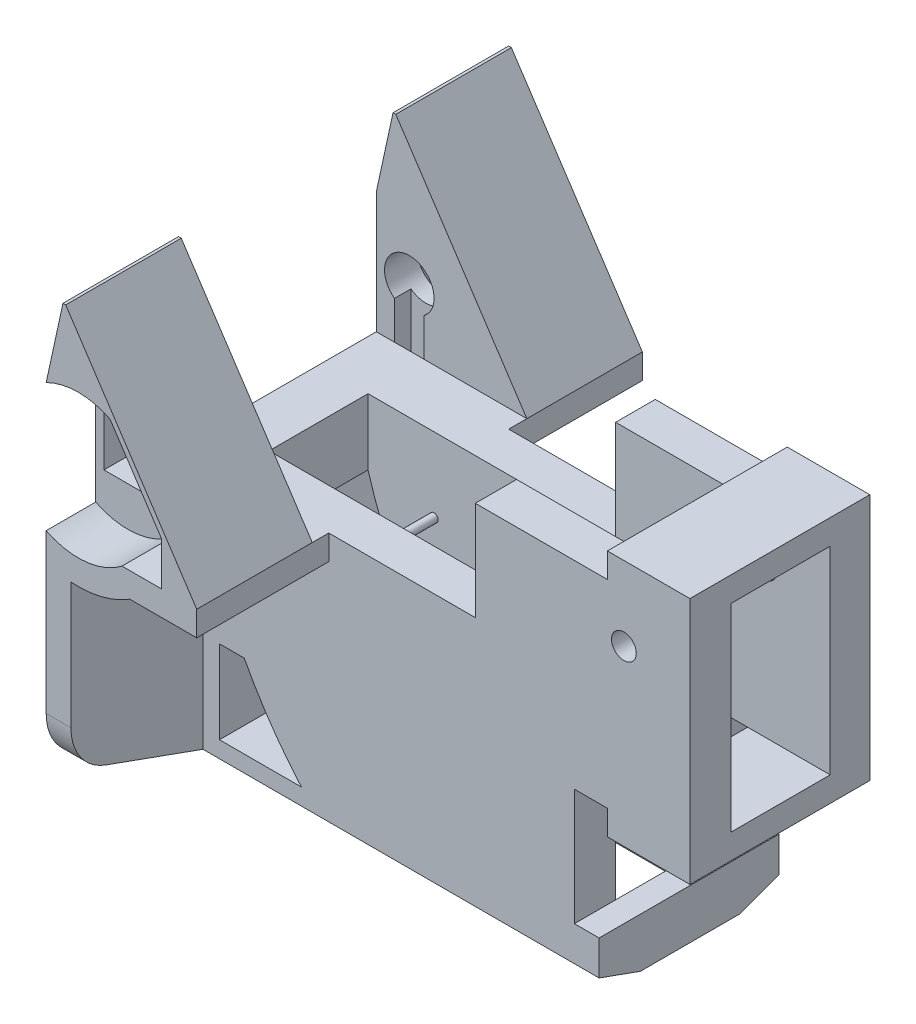
from build123d import *

# Parameters (mm, degrees)
EXTRUDE_1_DEPTH           = 30
EXTRUDE_2_DEPTH           = 210
SKETCH_8_W                = 25
SKETCH_8_H                = 120
EXTRUDE_5_DEPTH           = 70
SKETCH_9_W                = 25
SKETCH_9_H                = 60
EXTRUDE_6_DEPTH           = 60
SKETCH_10_R               = 7.5
CUT_EXTRUDE_3_DEPTH       = 402.372644808
EXTRUDE_7_DEPTH           = 60
EXTRUDE_8_REACH           = 392.16
SKETCH_12_R               = 2.5
SKETCH_14_W               = 125
SKETCH_14_H               = 50
EXTRUDE_9_DEPTH           = 120
SKETCH_15_W               = 70
SKETCH_15_H               = 70
CUT_EXTRUDE_4_DEPTH       = 10
CUT_EXTRUDE_5_DEPTH       = 20
SKETCH_17_R               = 43.471266984
CUT_EXTRUDE_6_DEPTH       = 428.317212384
EXTRUDE_10_DEPTH          = 20
EXTRUDE_11_DEPTH          = 20
CUT_EXTRUDE_7_DEPTH       = 434.012701892
CUT_EXTRUDE_8_DEPTH       = 434.012701892
EXTRUDE_19_REACH          = 446.86
EXTRUDE_20_DEPTH          = 20
EXTRUDE_21_DEPTH          = 20
EXTRUDE_START             = 20
EXTRUDE_22_DEPTH          = 20
CUT_EXTRUDE_9_DEPTH       = 30
CUT_EXTRUDE_11_DEPTH      = 407.201920232
CUT_EXTRUDE_11_DEPTH_BACK = 407.201920232
SKETCH_29_R               = 15
EXTRUDE_23_DEPTH          = 78.20324
SKETCH_33_W               = 30
SKETCH_33_H               = 40
CUT_EXTRUDE_14_DEPTH      = 20
SKETCH_34_W               = 18
SKETCH_34_H               = 35.300600551
CUT_EXTRUDE_15_DEPTH      = 10
CUT_EXTRUDE_16_DEPTH      = 10
SKETCH_36_RX              = 24.05
SKETCH_36_RY              = 15.9
SKETCH_36_R               = 15.9
CUT_EXTRUDE_17_DEPTH      = 4
SKETCH_37_W               = 148.788525811
SKETCH_37_H               = 80
CUT_EXTRUDE_18_DEPTH      = 445.859528391
SKETCH_38_W               = 76.211474189
SKETCH_38_H               = 51.3
CUT_EXTRUDE_20_DEPTH      = 80
CUT_EXTRUDE_START         = -81
CUT_EXTRUDE_21_DEPTH      = 81
CUT_EXTRUDE_22_DEPTH      = 402.372644808
SKETCH_41_W               = 18
SKETCH_41_H               = 10
CUT_EXTRUDE_23_DEPTH      = 60
SKETCH_44_W               = 50
SKETCH_44_H               = 109
EXTRUDE_26_DEPTH          = 15
SKETCH_45_W               = 50
SKETCH_45_H               = 109
EXTRUDE_27_DEPTH          = 15
EXTRUDE_28_DEPTH          = 15
SKETCH_47_W               = 15
SKETCH_47_H               = 50.339258453
CUT_EXTRUDE_24_DEPTH      = 109


with BuildPart() as part:
    # 草图1 → 凸台-拉伸1 (new body)
    with BuildSketch(Plane(origin=(0, 0, 0), x_dir=(0, 0, -1), z_dir=(1, 0, 0))):
        with BuildLine():
            Line((0, 0), (270, 0))
            Line((270, 0), (270, -100.282814983))
            ThreePointArc((270, -100.282814983), (264.178138298, -118.691056762), (248.830033233, -130.404003019))
            Line((248.830033233, -130.404003019), (142.45524498, -168.69892679))
            ThreePointArc((142.45524498, -168.69892679), (135, -170), (127.54475502, -168.69892679))
            Line((127.54475502, -168.69892679), (21.169966767, -130.404003019))
            ThreePointArc((21.169966767, -130.404003019), (5.821861702, -118.691056762), (0, -100.282814983))
            Line((0, -100.282814983), (0, 0))
        make_face()
    extrude(amount=EXTRUDE_1_DEPTH)

    # 草图2 → 凸台-拉伸2 (add)
    with BuildSketch(Plane(origin=(30, 0, 0), x_dir=(0, 0, -1), z_dir=(1, 0, 0))):
        with BuildLine():
            Line((105, -160.582814983), (105, 0))
            Line((105, 0), (0, 0))
            Line((0, 0), (0, -100.282814983))
            ThreePointArc((0, -100.282814983), (5.821861702, -118.691056762), (21.169966767, -130.404003019))
            Line((21.169966767, -130.404003019), (105, -160.582814983))
        make_face()
        with BuildLine():
            Line((270, 0), (165, 0))
            Line((165, 0), (165, -160.582814983))
            Line((165, -160.582814983), (248.830033233, -130.404003019))
            ThreePointArc((248.830033233, -130.404003019), (264.178138298, -118.691056762), (270, -100.282814983))
            Line((270, -100.282814983), (270, 0))
        make_face()
    extrude(amount=EXTRUDE_2_DEPTH)

    # 草图8 → 凸台-拉伸5 (add)
    with BuildSketch(Plane(origin=(240, 0, 0), x_dir=(0, 0, -1), z_dir=(1, 0, 0))):
        with Locations((92.5, 0)):
            Rectangle(SKETCH_8_W, SKETCH_8_H)
        with Locations((177.5, 0)):
            Rectangle(SKETCH_8_W, SKETCH_8_H)
    extrude(amount=EXTRUDE_5_DEPTH)

    # 草图9 → 凸台-拉伸6 (add)
    with BuildSketch(Plane.ZY.offset(-240)):
        with Locations((-92.5, 30)):
            Rectangle(SKETCH_9_W, SKETCH_9_H)
        with Locations((-177.5, 30)):
            Rectangle(SKETCH_9_W, SKETCH_9_H)
    extrude(amount=EXTRUDE_6_DEPTH)

    # 草图10 → 切除-拉伸3 (cut, through all)
    with BuildSketch(Plane.XY.offset(-80)):
        with Locations((270, 30)):
            Circle(SKETCH_10_R)
    extrude(amount=-CUT_EXTRUDE_3_DEPTH, mode=Mode.SUBTRACT)

    # 草图11 → 凸台-拉伸7 (add)
    with BuildSketch(Plane(origin=(0, 0, -105), x_dir=(-1, 0, 0), z_dir=(0, 0, -1))):
        with BuildLine():
            Line((-30, -40), (-30, -160.582814983))
            Line((-30, -160.582814983), (-108.203242822, -160.582814983))
            ThreePointArc((-108.203242822, -160.582814983), (-60.24964282, -106.032303748), (-30, -40))
        make_face()
    extrude(amount=EXTRUDE_7_DEPTH)

    # 草图12 → 凸台-拉伸8 (add, up to next)
    with BuildSketch(Plane.XY.offset(-165), mode=Mode.PRIVATE) as extrude_8_sk1:
        with Locations(Location((70, -45, 0), (0, 0, 180))):
            Circle(SKETCH_12_R)
    extrude_8_tool1 = extrude(extrude_8_sk1.sketch, amount=EXTRUDE_8_REACH, mode=Mode.PRIVATE) - part.part
    add(extrude_8_tool1.solids().sort_by_distance((70, -45, -165))[0])

    # 草图14 → 凸台-拉伸9 (add)
    with BuildSketch(Plane(origin=(0, 0, 0), x_dir=(1, 0, 0), z_dir=(0, 1, 0))):
        with Locations((62.5, 225)):
            Rectangle(SKETCH_14_W, SKETCH_14_H)
        with Locations((62.5, 45)):
            Rectangle(SKETCH_14_W, SKETCH_14_H)
    extrude(amount=EXTRUDE_9_DEPTH)

    # 草图15 → 切除-拉伸4 (cut)
    with BuildSketch(Plane.XY.offset(-20)):
        with Locations((35, 35)):
            Rectangle(SKETCH_15_W, SKETCH_15_H)
    extrude(amount=-CUT_EXTRUDE_4_DEPTH, mode=Mode.SUBTRACT)

    # 草图16 → 切除-拉伸5 (cut)
    with BuildSketch(Plane.XY.offset(-30)):
        Polygon((35, 15), (5, 15), (5, 55), (35, 55), (35, 35), align=None)
    extrude(amount=-CUT_EXTRUDE_5_DEPTH, mode=Mode.SUBTRACT)

    # 草图17 → 切除-拉伸6 (cut, through all)
    with BuildSketch(Plane.XY.offset(-30)):
        with Locations((19.5, 34.5)):
            Circle(SKETCH_17_R)
    extrude(amount=CUT_EXTRUDE_6_DEPTH, mode=Mode.SUBTRACT)

    # 草图18 → 凸台-拉伸10 (add)
    with BuildSketch(Plane.XY.offset(-20)):
        Polygon((11.819921283, 120), (91.211474189, 0), (87.317867735, 0), (10.741661946, 115.744614613), align=None)
    extrude(amount=EXTRUDE_10_DEPTH)

    # 草图19 → 凸台-拉伸11 (add)
    with BuildSketch(Plane.XY.offset(-20)):
        with BuildLine():
            Line((1.857343832, 74.230186717), (10.856035233, 115.571739869))
            Line((10.856035233, 115.571739869), (10.741661946, 115.744614613))
            Line((10.741661946, 115.744614613), (11.819921283, 120))
            Line((11.819921283, 120), (10.153664863, 120))
            Line((10.153664863, 120), (0, 73.352297914))
            ThreePointArc((0, 73.352297914), (0.923485284, 73.80221564), (1.857343832, 74.230186717))
        make_face()
    extrude(amount=EXTRUDE_11_DEPTH)

    # 草图20 → 切除-拉伸7 (cut, through all)
    with BuildSketch(Plane.XY.offset(-20)):
        Polygon((0, 120), (0, 73.352297914), (10.153664863, 120), align=None)
    extrude(amount=-CUT_EXTRUDE_7_DEPTH, mode=Mode.SUBTRACT)

    # 草图22 → 切除-拉伸8 (cut, through all)
    with BuildSketch(Plane.XY.offset(-20)):
        Polygon((44.899734993, 70), (70, 32.061054476), (91.211474189, 0), (125, 0), (125, 120), (11.819921283, 120), align=None)
    extrude(amount=-CUT_EXTRUDE_8_DEPTH, mode=Mode.SUBTRACT)

    # 草图23 → 凸台-拉伸19 (add, up to next)
    with BuildSketch(Plane.XY, mode=Mode.PRIVATE) as extrude_19_sk1:
        with BuildLine():
            Line((87.317867735, 0), (91.211474189, 0))
            Line((91.211474189, 0), (11.819921283, 120))
            Line((11.819921283, 120), (10.153664863, 120))
            Line((10.153664863, 120), (0, 73.352297914))
            ThreePointArc((0, 73.352297914), (0.923485284, 73.80221564), (1.857343832, 74.230186717))
            Line((1.857343832, 74.230186717), (10.856035233, 115.571739869))
            Line((10.856035233, 115.571739869), (87.317867735, 0))
        make_face()
    extrude_19_tool1 = extrude(extrude_19_sk1.sketch, amount=-EXTRUDE_19_REACH, mode=Mode.PRIVATE) - part.part
    add(extrude_19_tool1.solids().sort_by_distance((89.264671, 1.5073, 0))[0])

    # 草图24 → 凸台-拉伸20 (add)
    with BuildSketch(Plane.XY.offset(-20)):
        Polygon((87.317867735, 0), (70, 26.175884614), (70, 0), align=None)
    extrude(amount=EXTRUDE_20_DEPTH)

    # 草图25 → 凸台-拉伸21 (add)
    with BuildSketch(Plane.XY.offset(-20)):
        with BuildLine():
            Line((38.684579851, 73.509011127), (10.856035233, 115.571739869))
            Line((10.856035233, 115.571739869), (1.857343832, 74.230186717))
            ThreePointArc((1.857343832, 74.230186717), (20.351120273, 77.962934179), (38.684579851, 73.509011127))
        make_face()
    extrude(amount=EXTRUDE_21_DEPTH)

    # 草图26 → 凸台-拉伸22 (add)
    with BuildSketch(Plane(origin=(0, 0, -250), x_dir=(-1, 0, 0), z_dir=(0, 0, -1)).offset(EXTRUDE_START)):
        with BuildLine():
            Line((-70, 26.175884614), (-38.684579851, 73.509011127))
            ThreePointArc((-38.684579851, 73.509011127), (-19.323897117, 77.970910285), (0, 73.352297914))
            Line((0, 73.352297914), (-10.153664863, 120))
            Line((-10.153664863, 120), (-11.819921283, 120))
            Line((-11.819921283, 120), (-91.211474189, 0))
            Line((-91.211474189, 0), (-240, 0))
            Line((-240, 0), (-240, -100.282814983))
            Line((-240, -100.282814983), (0, -100.282814983))
            Line((0, -100.282814983), (0, -4.352297914))
            ThreePointArc((0, -4.352297914), (-23.599339693, -8.77755154), (-45.948082222, 0))
            Line((-45.948082222, 0), (-70, 0))
            Line((-70, 0), (-70, 26.175884614))
        make_face()
    extrude(amount=-EXTRUDE_22_DEPTH)

    # 草图27 → 切除-拉伸9 (cut)
    with BuildSketch(Plane(origin=(0, 0, -270), x_dir=(-1, 0, 0), z_dir=(0, 0, -1))):
        with BuildLine():
            Line((-38.684579851, 73.509011127), (-70, 26.175884614))
            Line((-70, 26.175884614), (-70, 0))
            Line((-70, 0), (-45.948082222, 0))
            ThreePointArc((-45.948082222, 0), (-23.599339693, -8.77755154), (0, -4.352297914))
            Line((0, -4.352297914), (0, 73.352297914))
            ThreePointArc((0, 73.352297914), (-19.323897117, 77.970910285), (-38.684579851, 73.509011127))
        make_face()
    extrude(amount=-CUT_EXTRUDE_9_DEPTH, mode=Mode.SUBTRACT)

    # 草图29 → 切除-拉伸11 (cut, two sides: drawn at the far end of the back side and taken through both)
    with BuildSketch(Plane(origin=(0, 0, -70), x_dir=(-1, 0, 0), z_dir=(0, 0, -1)).offset(-CUT_EXTRUDE_11_DEPTH_BACK)):
        with Locations((-20, 35)):
            Circle(SKETCH_29_R)
    extrude(amount=CUT_EXTRUDE_11_DEPTH + CUT_EXTRUDE_11_DEPTH_BACK, mode=Mode.SUBTRACT)

    # 草图30 → 凸台-拉伸23 (add)
    with BuildSketch(Plane(origin=(30, 0, 0), x_dir=(0, 0, -1), z_dir=(1, 0, 0))):
        with BuildLine():
            Line((142.45524498, -168.69892679), (165, -160.582814983))
            Line((165, -160.582814983), (105, -160.582814983))
            Line((105, -160.582814983), (127.54475502, -168.69892679))
            ThreePointArc((127.54475502, -168.69892679), (135, -170), (142.45524498, -168.69892679))
        make_face()
    extrude(amount=EXTRUDE_23_DEPTH)

    # 草图33 → 切除-拉伸14 (cut)
    with BuildSketch(Plane(origin=(0, 0, -240), x_dir=(-1, 0, 0), z_dir=(0, 0, -1))):
        with Locations((-20, 35)):
            Rectangle(SKETCH_33_W, SKETCH_33_H)
    extrude(amount=-CUT_EXTRUDE_14_DEPTH, mode=Mode.SUBTRACT)

    # 草图34 → 切除-拉伸15 (cut)
    with BuildSketch(Plane.XY.offset(-200)):
        with Locations((20, 17.650300276)):
            Rectangle(SKETCH_34_W, SKETCH_34_H)
    extrude(amount=-CUT_EXTRUDE_15_DEPTH, mode=Mode.SUBTRACT)

    # 草图35 → 切除-拉伸16 (cut)
    with BuildSketch(Plane(origin=(0, 0, -70), x_dir=(-1, 0, 0), z_dir=(0, 0, -1))):
        with BuildLine():
            Line((-11, 0), (-11, 23))
            ThreePointArc((-11, 23), (-20, 20), (-29, 23))
            Line((-29, 23), (-29, 0))
            Line((-29, 0), (-11, 0))
        make_face()
    extrude(amount=-CUT_EXTRUDE_16_DEPTH, mode=Mode.SUBTRACT)

    # 草图36 → 切除-拉伸17 (cut)
    # profile 1 of 6: a face of its own
    with BuildSketch(Plane.ZY):
        with Locations((-235.69166945, -100.008005659)):
            Ellipse(SKETCH_36_RX, SKETCH_36_RY)
        with Locations((-235.69166945, -100.008005659)):
            Circle(SKETCH_36_R, mode=Mode.SUBTRACT)
    # profile 2 of 6: a face of its own
    with BuildSketch(Plane.ZY):
        with Locations((-235.69166945, -100.008005659)):
            Ellipse(SKETCH_36_RX, SKETCH_36_RY)
        with Locations((-235.69166945, -100.008005659)):
            Circle(SKETCH_36_R, mode=Mode.SUBTRACT)
    # profile 3 of 6: a face of its own
    with BuildSketch(Plane.ZY):
        with Locations((-235.69166945, -100.008005659)):
            Circle(SKETCH_36_R)
    # profile 4 of 6: a face of its own
    with BuildSketch(Plane.ZY):
        with Locations(Location((-34.30833055, -100.008005659), (0, 0, 180))):
            Ellipse(SKETCH_36_RX, SKETCH_36_RY)
        with Locations((-34.30833055, -100.008005659)):
            Circle(SKETCH_36_R, mode=Mode.SUBTRACT)
    # profile 5 of 6: a face of its own
    with BuildSketch(Plane.ZY):
        with Locations(Location((-34.30833055, -100.008005659), (0, 0, 180))):
            Ellipse(SKETCH_36_RX, SKETCH_36_RY)
        with Locations((-34.30833055, -100.008005659)):
            Circle(SKETCH_36_R, mode=Mode.SUBTRACT)
    # profile 6 of 6: a face of its own
    with BuildSketch(Plane.ZY):
        with Locations((-34.30833055, -100.008005659)):
            Circle(SKETCH_36_R)
    extrude(amount=-CUT_EXTRUDE_17_DEPTH, mode=Mode.SUBTRACT)

    # 草图37 → 切除-拉伸18 (cut, through all)
    with BuildSketch(Plane(origin=(0, 0, 0), x_dir=(1, 0, 0), z_dir=(0, 1, 0))):
        with Locations((165.605737095, 40)):
            Rectangle(SKETCH_37_W, SKETCH_37_H)
        with Locations((165.605737095, 230)):
            Rectangle(SKETCH_37_W, SKETCH_37_H)
    extrude(amount=-CUT_EXTRUDE_18_DEPTH, mode=Mode.SUBTRACT)

    # 草图38 → 切除-拉伸20 (cut)
    with BuildSketch(Plane.XY):
        with Locations((53.105737095, -125.932814983)):
            Rectangle(SKETCH_38_W, SKETCH_38_H)
        Polygon((91.211474189, -15), (76.211474189, -15), (76.211474189, -85.282814983), (15, -85.282814983), (15, -100.282814983), (91.211474189, -100.282814983), align=None)
        with BuildLine():
            ThreePointArc((15, -23.79784784), (33.51949079, -22.265684535), (50.622966805, -15))
            Line((50.622966805, -15), (70, -15))
            Line((70, -15), (76.211474189, -15))
            Line((76.211474189, -15), (76.211474189, -85.282814983))
            Line((76.211474189, -85.282814983), (15, -85.282814983))
            Line((15, -85.282814983), (15, -23.79784784))
        make_face()
    extrude(amount=-CUT_EXTRUDE_20_DEPTH, mode=Mode.SUBTRACT)

    # 草图39 → 切除-拉伸21 (cut)
    with BuildSketch(Plane(origin=(0, 0, -270), x_dir=(-1, 0, 0), z_dir=(0, 0, -1)).offset(CUT_EXTRUDE_START)):
        with BuildLine():
            Line((-180, 60), (-310, 60))
            Line((-310, 60), (-310, -60))
            Line((-310, -60), (-240, -60))
            Line((-240, -60), (-240, -151.582814983))
            Line((-240, -151.582814983), (-15, -151.582814983))
            Line((-15, -151.582814983), (-15, -23.79784784))
            ThreePointArc((-15, -23.79784784), (-33.51949079, -22.265684535), (-50.622966805, -15))
            Line((-50.622966805, -15), (-91.211474189, -15))
            Line((-91.211474189, -15), (-91.211474189, 0))
            Line((-91.211474189, 0), (-180, 0))
            Line((-180, 0), (-180, 60))
        make_face()
    extrude(amount=CUT_EXTRUDE_21_DEPTH, mode=Mode.SUBTRACT)

    # 草图40 → 切除-拉伸22 (cut, through all)
    with BuildSketch(Plane.XY.offset(-80)):
        with BuildLine():
            Line((74.655848302, -141.582814983), (40, -141.582814983))
            Line((40, -141.582814983), (40, -91.24355653))
            ThreePointArc((40, -91.24355653), (55.843697078, -117.43499557), (74.655848302, -141.582814983))
        make_face()
    extrude(amount=-CUT_EXTRUDE_22_DEPTH, mode=Mode.SUBTRACT)

    # 草图41 → 切除-拉伸23 (cut)
    with BuildSketch(Plane(origin=(0, 0, 0), x_dir=(1, 0, 0), z_dir=(0, 1, 0))):
        with Locations((20, 65)):
            Rectangle(SKETCH_41_W, SKETCH_41_H)
        with Locations((20, 205)):
            Rectangle(SKETCH_41_W, SKETCH_41_H)
    extrude(amount=-CUT_EXTRUDE_23_DEPTH, mode=Mode.SUBTRACT)

    # 草图44 → 凸台-拉伸26 (add)
    with BuildSketch(Plane(origin=(0, 60, 0), x_dir=(1, 0, 0), z_dir=(0, 1, 0))):
        with Locations((285, 134.5)):
            Rectangle(SKETCH_44_W, SKETCH_44_H)
    extrude(amount=EXTRUDE_26_DEPTH)

    # 草图45 → 凸台-拉伸27 (add)
    with BuildSketch(Plane.XZ.offset(60)):
        with Locations((285, -134.5)):
            Rectangle(SKETCH_45_W, SKETCH_45_H)
    extrude(amount=EXTRUDE_27_DEPTH)

    # 草图46 → 凸台-拉伸28 (add)
    with BuildSketch(Plane(origin=(240, 0, 0), x_dir=(0, 0, -1), z_dir=(1, 0, 0))):
        Polygon((80, -151.582814983), (105, -160.582814983), (165, -160.582814983), (189, -151.942814983), (189, -130.582814983), (80, -130.582814983), align=None)
    extrude(amount=EXTRUDE_28_DEPTH)

    # 草图47 → 切除-拉伸24 (cut)
    with BuildSketch(Plane(origin=(0, 0, -189), x_dir=(-1, 0, 0), z_dir=(0, 0, -1))):
        with Locations((-32.5, -116.413185757)):
            Rectangle(SKETCH_47_W, SKETCH_47_H)
    extrude(amount=-CUT_EXTRUDE_24_DEPTH, mode=Mode.SUBTRACT)


solid = part.part
